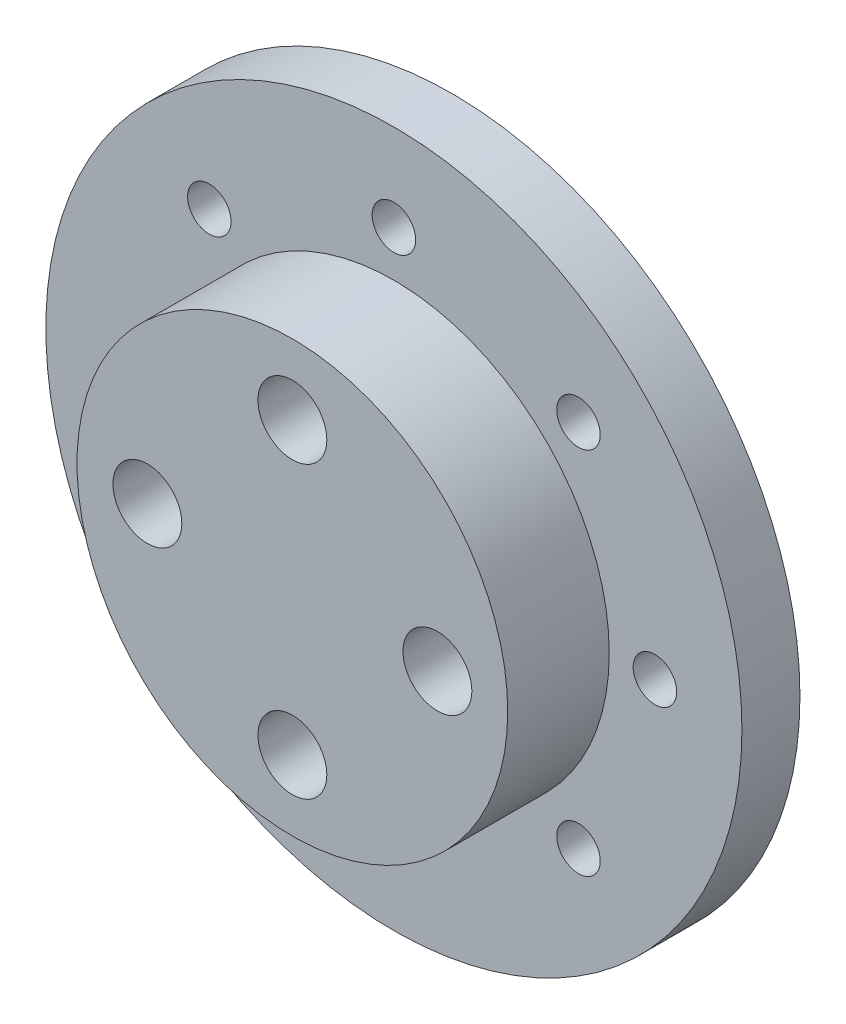
from build123d import *

# Parameters (mm, degrees)
ESQUISSE1_R             = 24
ESQUISSE1_R_2           = 1.5
ESQUISSE1_R_3           = 3
BOSS_EXTRU_1_DEPTH      = 4
ESQUISSE2_R             = 14.85
BOSS_EXTRU_2_DEPTH      = 7
ESQUISSE3_R             = 2.375
ENL_V_MAT_EXTRU_1_DEPTH = 10


with BuildPart() as part:
    # Esquisse1 → Boss.-Extru.1 (new body)
    with BuildSketch(Plane.XY):
        Circle(ESQUISSE1_R)
        with Locations((0, 18)):
            Circle(ESQUISSE1_R_2, mode=Mode.SUBTRACT)
        with Locations((12.727922061, 12.727922061)):
            Circle(ESQUISSE1_R_2, mode=Mode.SUBTRACT)
        with Locations((18, 0)):
            Circle(ESQUISSE1_R_2, mode=Mode.SUBTRACT)
        with Locations((12.727922061, -12.727922061)):
            Circle(ESQUISSE1_R_2, mode=Mode.SUBTRACT)
        with Locations((0, -18)):
            Circle(ESQUISSE1_R_2, mode=Mode.SUBTRACT)
        with Locations((-12.727922061, -12.727922061)):
            Circle(ESQUISSE1_R_2, mode=Mode.SUBTRACT)
        with Locations((-18, 0)):
            Circle(ESQUISSE1_R_2, mode=Mode.SUBTRACT)
        with Locations((-12.727922061, 12.727922061)):
            Circle(ESQUISSE1_R_2, mode=Mode.SUBTRACT)
        Circle(ESQUISSE1_R_3, mode=Mode.SUBTRACT)
    extrude(amount=BOSS_EXTRU_1_DEPTH)

    # Esquisse2 → Boss.-Extru.2 (add)
    with BuildSketch(Plane.XY.offset(4)):
        Circle(ESQUISSE2_R)
    extrude(amount=BOSS_EXTRU_2_DEPTH)

    # Esquisse3 → Enlèv. mat.-Extru.1 (cut)
    with BuildSketch(Plane.XY.offset(11)):
        with Locations((0, 10)):
            Circle(ESQUISSE3_R)
        with Locations((10, 0)):
            Circle(ESQUISSE3_R)
        with Locations((0, -10)):
            Circle(ESQUISSE3_R)
        with Locations((-10, 0)):
            Circle(ESQUISSE3_R)
    extrude(amount=-ENL_V_MAT_EXTRU_1_DEPTH, mode=Mode.SUBTRACT)


solid = part.part
